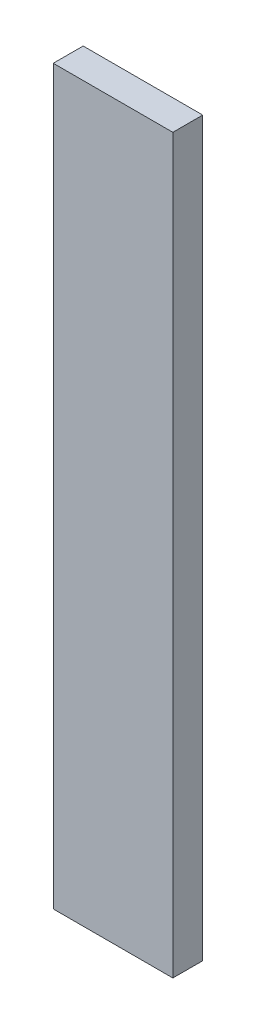
from build123d import *

# Parameters (mm, degrees)
SKETCH1_W           = 50.8
SKETCH1_H           = 311.15
BOSS_EXTRUDE1_DEPTH = 12.7


with BuildPart() as part:
    # Sketch1 → Boss-Extrude1 (new body)
    with BuildSketch(Plane.XY):
        Rectangle(SKETCH1_W, SKETCH1_H)
    extrude(amount=BOSS_EXTRUDE1_DEPTH)


solid = part.part
